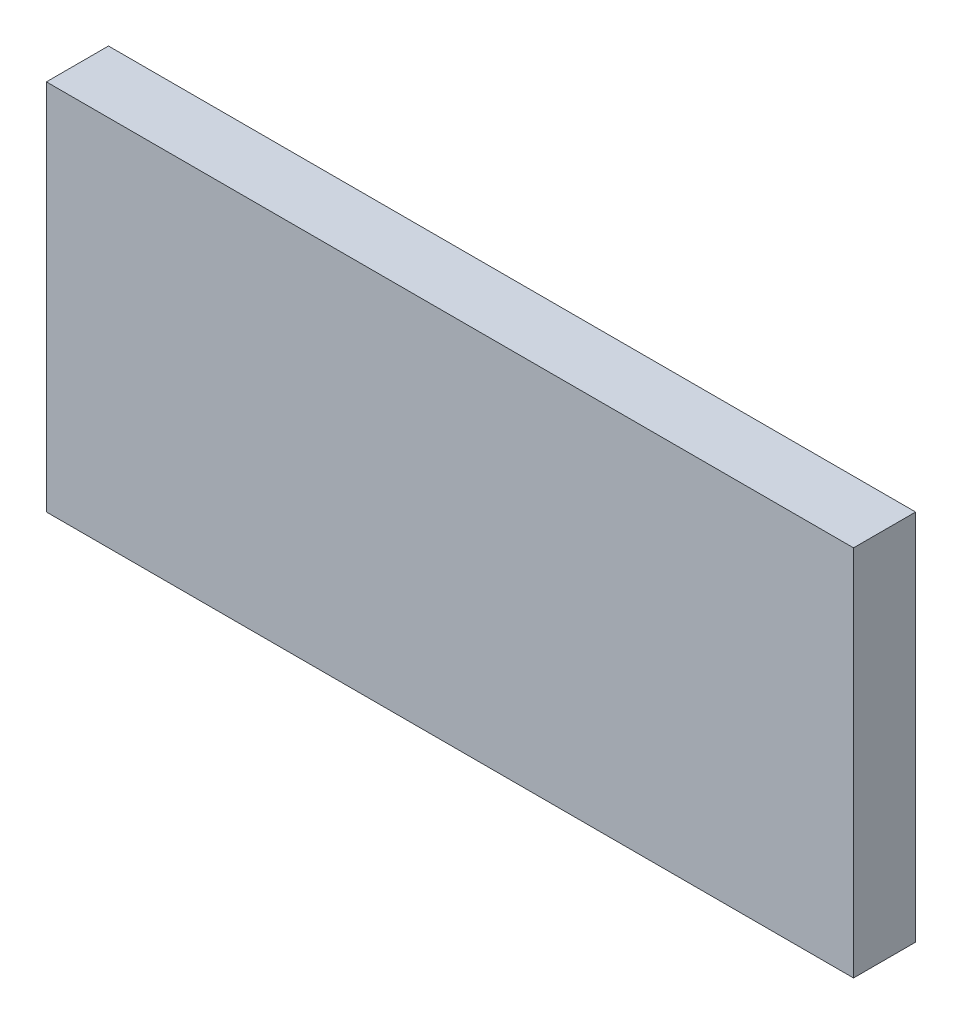
from build123d import *

# Parameters (mm, degrees)
SKETCH1_W           = 65
SKETCH1_H           = 30
BOSS_EXTRUDE1_DEPTH = 5


with BuildPart() as part:
    # Sketch1 → Boss-Extrude1 (new body)
    with BuildSketch(Plane.XY):
        Rectangle(SKETCH1_W, SKETCH1_H)
    extrude(amount=BOSS_EXTRUDE1_DEPTH)


solid = part.part
